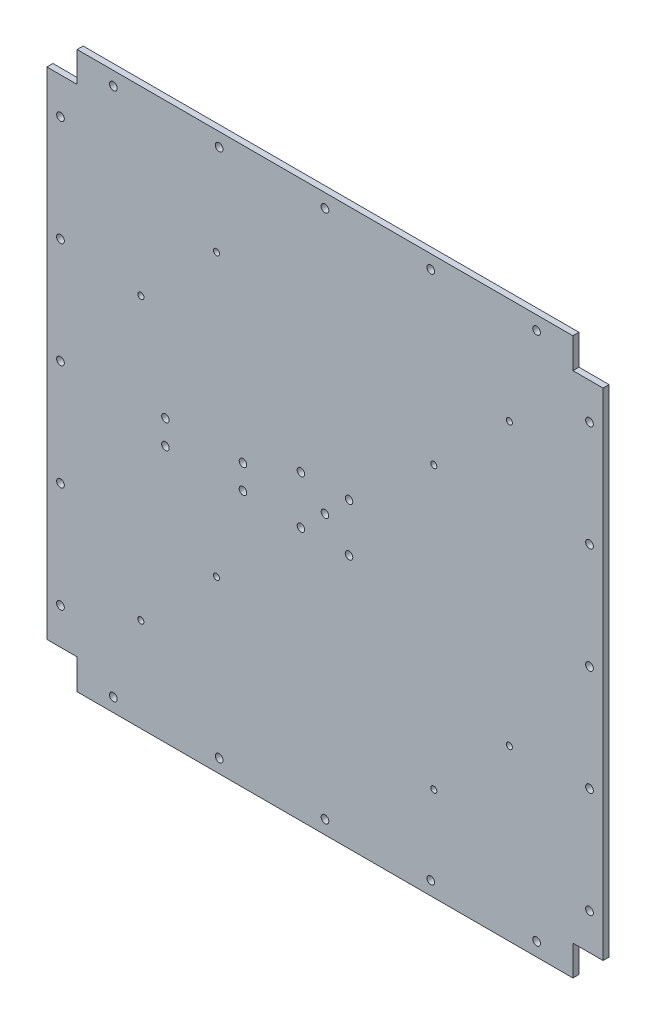
from build123d import *

# Parameters (mm, degrees)
SKETCH_1_W          = 368
SKETCH_1_H          = 368
EXTRUDE_1_DEPTH     = 4
SKETCH_3_R          = 2.55
CUT_EXTRUDE_2_DEPTH = 261.246037434
SKETCH_4_W          = 20
SKETCH_4_H          = 20
CUT_EXTRUDE_3_DEPTH = 261.246037434
SKETCH_5_R          = 2.5
CUT_EXTRUDE_6_DEPTH = 10
SKETCH_6_R          = 2
SKETCH_6_R_2        = 2.0450624
SKETCH_6_R_3        = 2.5
CUT_EXTRUDE_7_DEPTH = 10


with BuildPart() as part:
    # 草图1 → 凸台-拉伸1 (new body)
    with BuildSketch(Plane.XY):
        Rectangle(SKETCH_1_W, SKETCH_1_H)
    extrude(amount=EXTRUDE_1_DEPTH)

    # 草图3 → 切除-拉伸2 (cut, through all)
    with BuildSketch(Plane.XY.offset(4)):
        with Locations((0, -175)):
            Circle(SKETCH_3_R)
        with Locations((70, -175)):
            Circle(SKETCH_3_R)
        with Locations((140, -175)):
            Circle(SKETCH_3_R)
        with Locations((-70, -175)):
            Circle(SKETCH_3_R)
        with Locations((-140, -175)):
            Circle(SKETCH_3_R)
        with Locations((-175, 140)):
            Circle(SKETCH_3_R)
        with Locations((-175, 70)):
            Circle(SKETCH_3_R)
        with Locations((-175, -70)):
            Circle(SKETCH_3_R)
        with Locations((-175, -140)):
            Circle(SKETCH_3_R)
        with Locations((-175, 0)):
            Circle(SKETCH_3_R)
        with Locations((140, 175)):
            Circle(SKETCH_3_R)
        with Locations((70, 175)):
            Circle(SKETCH_3_R)
        with Locations((-70, 175)):
            Circle(SKETCH_3_R)
        with Locations((-140, 175)):
            Circle(SKETCH_3_R)
        with Locations((0, 175)):
            Circle(SKETCH_3_R)
        with Locations((175, -140)):
            Circle(SKETCH_3_R)
        with Locations((175, -70)):
            Circle(SKETCH_3_R)
        with Locations((175, 70)):
            Circle(SKETCH_3_R)
        with Locations((175, 140)):
            Circle(SKETCH_3_R)
        with Locations((175, 0)):
            Circle(SKETCH_3_R)
    extrude(amount=-CUT_EXTRUDE_2_DEPTH, mode=Mode.SUBTRACT)

    # 草图4 → 切除-拉伸3 (cut, through all)
    with BuildSketch(Plane.XY.offset(4)):
        with Locations((-174, 174)):
            Rectangle(SKETCH_4_W, SKETCH_4_H)
        with Locations((-174, -174)):
            Rectangle(SKETCH_4_W, SKETCH_4_H)
        with Locations((174, 174)):
            Rectangle(SKETCH_4_W, SKETCH_4_H)
        with Locations((174, -174)):
            Rectangle(SKETCH_4_W, SKETCH_4_H)
    extrude(amount=-CUT_EXTRUDE_3_DEPTH, mode=Mode.SUBTRACT)

    # 草图5 → 切除-拉伸6 (cut)
    with BuildSketch(Plane.XY.offset(4)):
        Circle(SKETCH_5_R)
        with Locations((-15.909902577, 15.909902577)):
            Circle(SKETCH_5_R)
        with Locations((15.909902577, 15.909902577)):
            Circle(SKETCH_5_R)
        with Locations((15.909902577, -15.909902577)):
            Circle(SKETCH_5_R)
        with Locations((-15.909902577, -15.909902577)):
            Circle(SKETCH_5_R)
    extrude(amount=-CUT_EXTRUDE_6_DEPTH, mode=Mode.SUBTRACT)

    # 草图6 → 切除-拉伸7 (cut)
    with BuildSketch(Plane(origin=(0, 0, 0), x_dir=(-1, 0, 0), z_dir=(0, 0, -1))):
        with Locations((121.8, -122)):
            Circle(SKETCH_6_R)
        with Locations((71.8, -72)):
            Circle(SKETCH_6_R)
        with Locations((-72, -122)):
            Circle(SKETCH_6_R)
        with Locations((-122, -72)):
            Circle(SKETCH_6_R)
        with Locations((-72, 64)):
            Circle(SKETCH_6_R)
        with Locations((-122, 114)):
            Circle(SKETCH_6_R)
        with Locations((121.8, 64)):
            Circle(SKETCH_6_R_2)
        with Locations((71.8, 114)):
            Circle(SKETCH_6_R)
        with Locations((105.553117778, -14)):
            Circle(SKETCH_6_R_3)
        with Locations((105.553117778, 2)):
            Circle(SKETCH_6_R_3)
        with Locations((54.253117778, -14)):
            Circle(SKETCH_6_R_3)
        with Locations((54.253117778, 2)):
            Circle(SKETCH_6_R_3)
    extrude(amount=-CUT_EXTRUDE_7_DEPTH, mode=Mode.SUBTRACT)


solid = part.part
